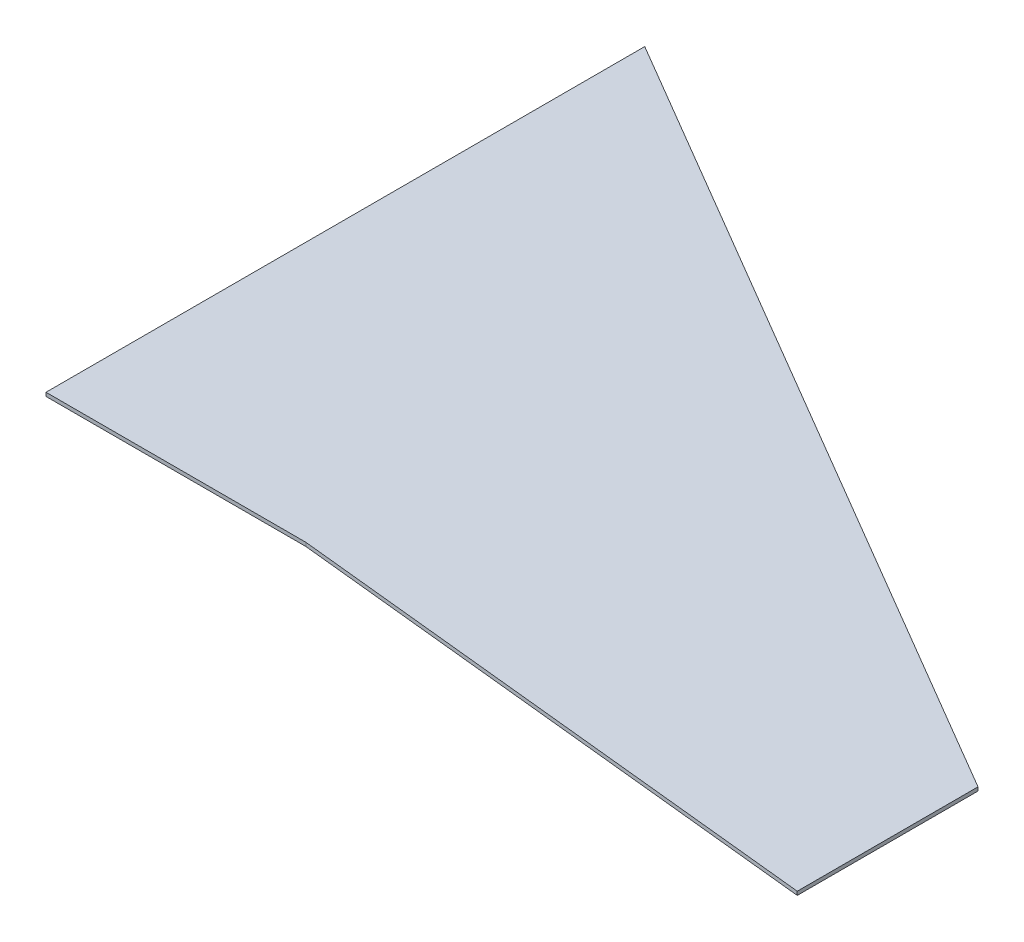
from build123d import *

# Parameters (mm, degrees)
BOSS_EXTRUDE1_DEPTH = 2.0574


with BuildPart() as part:
    # Sketch1 → Boss-Extrude1 (new body)
    with BuildSketch(Plane(origin=(0, 0, 0), x_dir=(1, 0, 0), z_dir=(0, 1, 0))):
        Polygon((0, 0), (0, 336.55), (454.025, 69.85), (454.025, -31.75), (146.05, 0), align=None)
    extrude(amount=BOSS_EXTRUDE1_DEPTH)


solid = part.part
